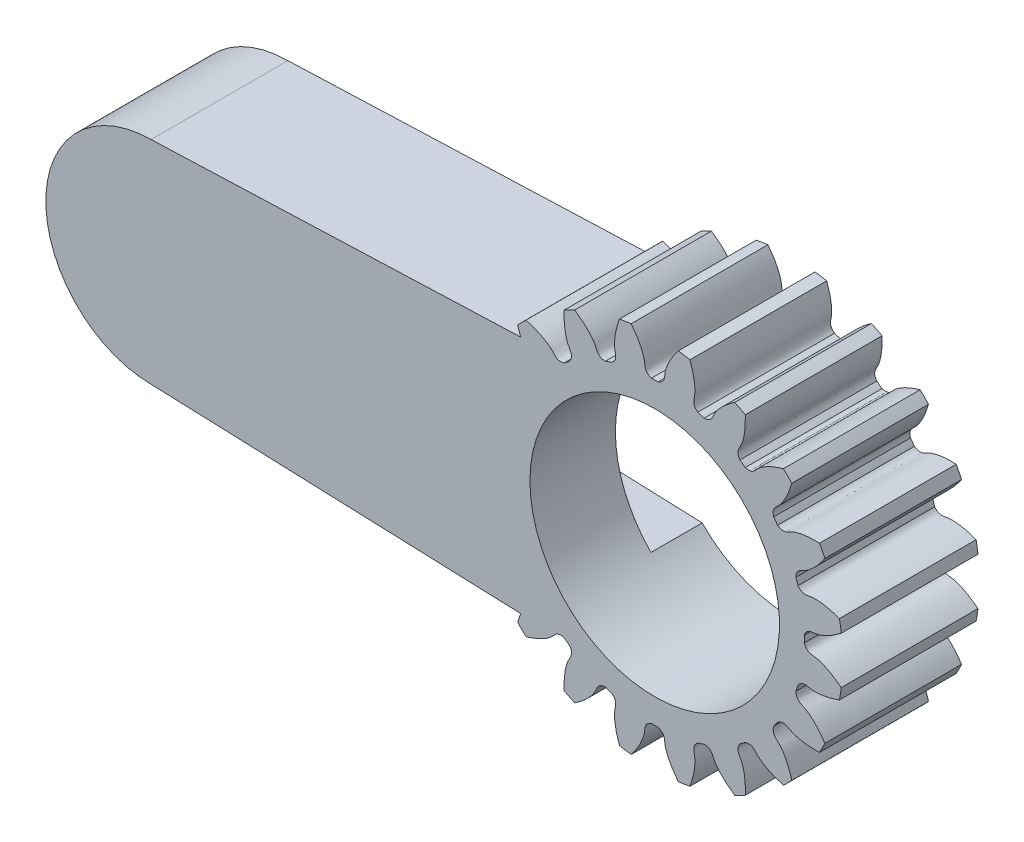
from build123d import *

# Parameters (mm, degrees)
SKETCH_1_R               = 5.5
EXTRUDE_1_DEPTH          = 4
CUT_EXTRUDE_1_DEPTH      = 9.746427842
PATTERN_CIRCULAR_1_COUNT = 20
SKETCH_4_R               = 3.65
CUT_EXTRUDE_2_DEPTH      = 9.692006634
EXTRUDE_4_DEPTH          = 1.5
CUT_EXTRUDE_3_DEPTH      = 1.5
EXTRUDE_START            = -4
EXTRUDE_3_DEPTH          = 2.5


with BuildPart() as part:
    # 草图1 → 凸台-拉伸1 (new body)
    with BuildSketch(Plane.XY):
        Circle(SKETCH_1_R)
    extrude(amount=EXTRUDE_1_DEPTH)

    # 草图2 → 切除-拉伸1 (cut, through all)
    with BuildSketch(Plane.XY):
        with BuildLine():
            ThreePointArc((0.0966583, 4.373932118), (0, 4.375), (-0.0966583, 4.373932118))
            add(Edge.make_bspline(
                [(-0.0966583, 4.373932118), (-0.305594702, 4.446737756), (-0.27854205, 4.593556849), (-0.306448528, 4.735004701), (-0.309446093, 4.748778307), (-0.313155445, 4.764317308), (-0.317646048, 4.781598418), (-0.32298957, 4.800595748), (-0.329256028, 4.821281414), (-0.336514936, 4.843625367), (-0.344834875, 4.867595474), (-0.35428355, 4.893157523), (-0.364927699, 4.92027525), (-0.376833051, 4.948910365), (-0.390064266, 4.979022576), (-0.404684882, 5.010569616), (-0.420757267, 5.043507275), (-0.438342558, 5.077789431), (-0.457500619, 5.113368075), (-0.478289983, 5.150193352), (-0.500767805, 5.18821359), (-0.524989813, 5.227375339), (-0.551010261, 5.267623403), (-0.578881878, 5.308900882), (-0.608655826, 5.35114921), (-0.64038165, 5.394308195), (-0.67410724, 5.43831606), (-0.709878781, 5.483109486), (-0.747740713, 5.528623656), (-0.787735693, 5.574792297), (-0.829904548, 5.621547731), (-0.874286244, 5.668820917), (-0.920917842, 5.716541501), (-0.969834463, 5.764637863), (-1.021069253, 5.81303717), (-1.074653349, 5.861665421), (-1.130615845, 5.910447505), (-1.188983759, 5.95930725), (-1.249782006, 6.008167473), (-1.313033367, 6.056950041), (-1.37875845, 6.10557592), (-1.470736795, 6.170819934), (-1.541966206, 6.218166301), (-1.590578991, 6.24912593)],
                knots=[0, 0, 0, 0, 0.165916003, 0.170905922, 0.176663519, 0.183188797, 0.190481754, 0.198542391, 0.207370708, 0.216966704, 0.22733038, 0.238461736, 0.250360771, 0.263027487, 0.276461881, 0.290663956, 0.30563371, 0.321371144, 0.337876258, 0.355149051, 0.373189524, 0.391997677, 0.411573509, 0.431917021, 0.453028213, 0.474907084, 0.497553636, 0.520967867, 0.545149777, 0.570099367, 0.595816637, 0.622301587, 0.649554216, 0.677574526, 0.706362514, 0.735918183, 0.766241531, 0.797332559, 0.829191267, 0.861817654, 0.895211721, 0.929373468, 1, 1, 1, 1], degree=3))
            ThreePointArc((-1.590578991, 6.24912593), (0, 6.44837316), (1.590578991, 6.24912593))
            add(Edge.make_bspline(
                [(0.0966583, 4.373932118), (0.305594702, 4.446737756), (0.27854205, 4.593556849), (0.306448528, 4.735004701), (0.309446093, 4.748778307), (0.313155445, 4.764317308), (0.317646048, 4.781598418), (0.32298957, 4.800595748), (0.329256028, 4.821281414), (0.336514936, 4.843625367), (0.344834875, 4.867595474), (0.35428355, 4.893157523), (0.364927699, 4.92027525), (0.376833051, 4.948910365), (0.390064266, 4.979022576), (0.404684882, 5.010569616), (0.420757267, 5.043507275), (0.438342558, 5.077789431), (0.457500619, 5.113368075), (0.478289983, 5.150193352), (0.500767805, 5.18821359), (0.524989813, 5.227375339), (0.551010261, 5.267623403), (0.578881878, 5.308900882), (0.608655826, 5.35114921), (0.64038165, 5.394308195), (0.67410724, 5.43831606), (0.709878781, 5.483109486), (0.747740713, 5.528623656), (0.787735693, 5.574792297), (0.829904548, 5.621547731), (0.874286244, 5.668820917), (0.920917842, 5.716541501), (0.969834463, 5.764637863), (1.021069253, 5.81303717), (1.074653349, 5.861665421), (1.130615845, 5.910447505), (1.188983759, 5.95930725), (1.249782006, 6.008167473), (1.313033367, 6.056950041), (1.37875845, 6.10557592), (1.470736795, 6.170819934), (1.541966206, 6.218166301), (1.590578991, 6.24912593)],
                knots=[0, 0, 0, 0, 0.165916003, 0.170905922, 0.176663519, 0.183188797, 0.190481754, 0.198542391, 0.207370708, 0.216966704, 0.22733038, 0.238461736, 0.250360771, 0.263027487, 0.276461881, 0.290663956, 0.30563371, 0.321371144, 0.337876258, 0.355149051, 0.373189524, 0.391997677, 0.411573509, 0.431917021, 0.453028213, 0.474907084, 0.497553636, 0.520967867, 0.545149777, 0.570099367, 0.595816637, 0.622301587, 0.649554216, 0.677574526, 0.706362514, 0.735918183, 0.766241531, 0.797332559, 0.829191267, 0.861817654, 0.895211721, 0.929373468, 1, 1, 1, 1], degree=3))
        make_face()
    cut_extrude_1 = extrude(amount=CUT_EXTRUDE_1_DEPTH, mode=Mode.SUBTRACT)

    # 阵列(圆周)1: 切除-拉伸1 ×20 about axis
    pattern_circular_1_axis = Axis((0, 0, 4), (0, 0, -1))
    for i in range(1, PATTERN_CIRCULAR_1_COUNT):
        add(cut_extrude_1.rotate(pattern_circular_1_axis, i * 360 / PATTERN_CIRCULAR_1_COUNT), mode=Mode.SUBTRACT)

    # 草图4 → 切除-拉伸2 (cut, through all)
    with BuildSketch(Plane(origin=(0, 0, 0), x_dir=(-1, 0, 0), z_dir=(0, 0, -1))):
        Circle(SKETCH_4_R)
    extrude(amount=-CUT_EXTRUDE_2_DEPTH, mode=Mode.SUBTRACT)

    # 草图5 → 拉伸-薄壁4 (add)
    with BuildSketch(Plane(origin=(0, 0, 0), x_dir=(-1, 0, 0), z_dir=(0, 0, -1))):
        with BuildLine():
            Line((14.731905059, 3.099932929), (1.611512971, 3.587881395))
            Line((1.611512971, 3.587881395), (1.611512971, -3.587881395))
            Line((1.611512971, -3.587881395), (14.731905059, -3.099932929))
            ThreePointArc((14.731905059, -3.099932929), (17.811512971, 0), (14.731905059, 3.099932929))
        make_face()
        with BuildLine():
            Line((14.711512971, 2.1), (2.611512971, 2.55))
            Line((2.611512971, 2.55), (2.611512971, -2.55))
            Line((2.611512971, -2.55), (14.711512971, -2.1))
            ThreePointArc((14.711512971, -2.1), (16.811512971, 0), (14.711512971, 2.1))
        make_face(mode=Mode.SUBTRACT)
    extrude(amount=-EXTRUDE_4_DEPTH)

    # 草图6 → 切除-拉伸3 (cut)
    with BuildSketch(Plane(origin=(0, 0, 0), x_dir=(-1, 0, 0), z_dir=(0, 0, -1))):
        with BuildLine():
            Line((2.611512971, 2.55), (5.936289918, 2.426351271))
            Line((5.936289918, 2.426351271), (5.936289918, -2.426351271))
            Line((5.936289918, -2.426351271), (2.611512971, -2.55))
            ThreePointArc((2.611512971, -2.55), (2.142402342, -2.955099356), (1.611512971, -3.274984877))
            Line((1.611512971, -3.274984877), (1.611512971, 3.274984877))
            ThreePointArc((1.611512971, 3.274984877), (2.142402342, 2.955099356), (2.611512971, 2.55))
        make_face()
    extrude(amount=-CUT_EXTRUDE_3_DEPTH, mode=Mode.SUBTRACT)

    # 草图7 → 凸台-拉伸3 (add)
    with BuildSketch(Plane(origin=(0, 0, 0), x_dir=(-1, 0, 0), z_dir=(0, 0, -1)).offset(EXTRUDE_START)):
        with BuildLine():
            Line((3.922129126, -3.501949389), (14.731905059, -3.099932929))
            ThreePointArc((14.731905059, -3.099932929), (17.811512971, 0), (14.731905059, 3.099932929))
            Line((14.731905059, 3.099932929), (3.922129124, 3.501949389))
            Line((3.922129124, 3.501949389), (2.611512971, 2.55))
            ThreePointArc((2.611512971, 2.55), (3.65, 0), (2.611512971, -2.55))
            Line((2.611512971, -2.55), (3.922129126, -3.501949389))
        make_face()
    extrude(amount=EXTRUDE_3_DEPTH)


solid = part.part
